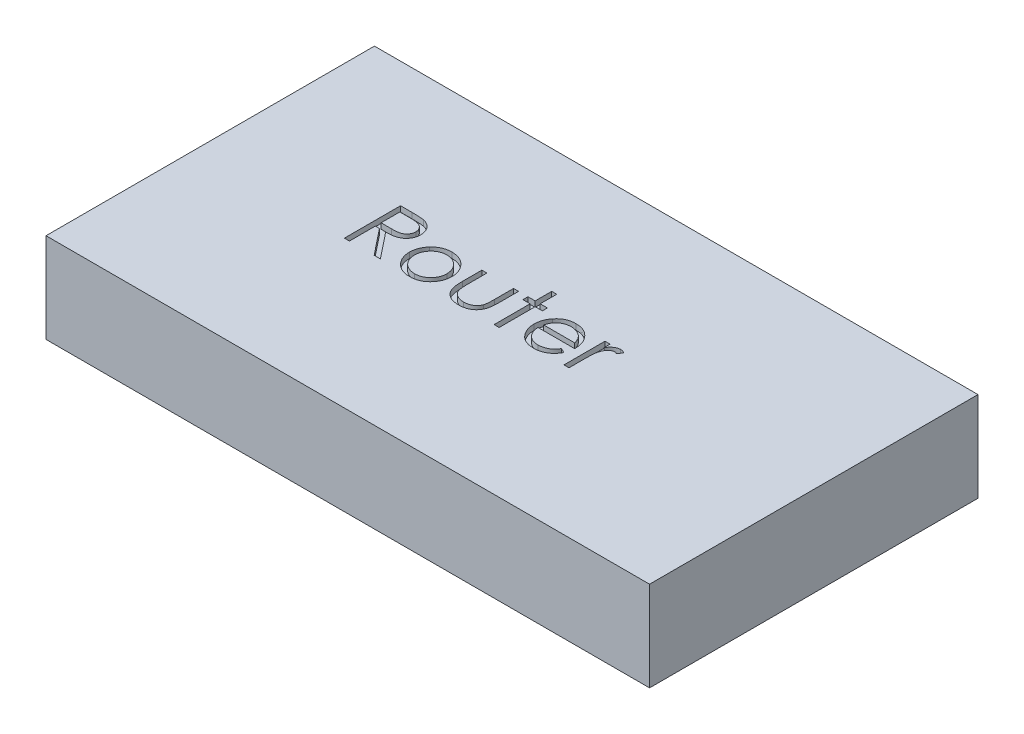
from build123d import *

# Parameters (mm, degrees)
SKETCH1_W           = 215
SKETCH1_H           = 117
BOSS_EXTRUDE1_DEPTH = 32
CUT_EXTRUDE2_DEPTH  = 2


with BuildPart() as part:
    # Sketch1 → Boss-Extrude1 (new body)
    with BuildSketch(Plane(origin=(0, 0, 0), x_dir=(1, 0, 0), z_dir=(0, 1, 0))):
        with Locations((-107.5, 58.5)):
            Rectangle(SKETCH1_W, SKETCH1_H)
    extrude(amount=BOSS_EXTRUDE1_DEPTH)

    # Sketch3 → Cut-Extrude2 (cut)
    # profile 1 of 6: a face of its own
    with BuildSketch(Plane(origin=(0, 32, 0), x_dir=(1, 0, 0), z_dir=(0, 1, 0))):
        with BuildLine():
            Line((-161.103395992, 72.399720579), (-157.100992146, 72.399720579))
            add(Edge.make_bspline(
                [(-157.100992146, 72.399720579), (-156.833899983, 72.398831516), (-156.321053444, 72.397124417), (-155.586349042, 72.387605772), (-154.91876563, 72.36032374), (-154.318652263, 72.33684612), (-153.786019949, 72.294035026), (-153.31923543, 72.253117043), (-152.920448587, 72.199553267), (-152.679043723, 72.149807993), (-152.569742146, 72.127284682)],
                knots=[0, 0, 0, 0, 1.410062039, 2.707475311, 3.878576406, 4.937260626, 5.877586885, 6.699081471, 7.410979367, 8, 8, 8, 8], degree=3))
            add(Edge.make_bspline(
                [(-152.569742146, 72.127284682), (-152.42341858, 72.091131737), (-152.133892926, 72.019597087), (-151.717035405, 71.868399368), (-151.319810697, 71.693430085), (-150.943868844, 71.487923112), (-150.591092894, 71.250352942), (-150.257845404, 70.984820814), (-149.942614185, 70.692779638), (-149.658147726, 70.366866258), (-149.389924574, 70.024943345), (-149.163703851, 69.655207592), (-148.968695395, 69.268570292), (-148.813435298, 68.861099333), (-148.688418307, 68.436746351), (-148.600268368, 67.991667513), (-148.547404438, 67.527890512), (-148.542022407, 67.211559605), (-148.539293428, 67.051162887)],
                knots=[0, 0, 0, 0, 1.027469482, 2.033020251, 3.019912614, 3.986113645, 4.951240523, 5.91722682, 6.890402269, 7.87763091, 8.8651537, 9.85103654, 10.82876324, 11.815024772, 12.821070561, 13.842952187, 14.906261191, 16, 16, 16, 16], degree=3))
            add(Edge.make_bspline(
                [(-148.539293428, 67.051162887), (-148.547687703, 66.784676575), (-148.564067108, 66.264692758), (-148.716781986, 65.51005915), (-148.966933527, 64.806120209), (-149.311638036, 64.153762278), (-149.750606468, 63.565701448), (-150.278176703, 63.04918456), (-150.894643055, 62.616956488), (-151.46852486, 62.317226176), (-151.975463144, 62.125266698), (-152.39279636, 61.99020179), (-152.848036231, 61.885847703), (-153.336821001, 61.792361236), (-153.861184746, 61.721780125), (-154.419870686, 61.670085299), (-155.013277266, 61.63777645), (-155.420929091, 61.632964993), (-155.630639582, 61.63048981)],
                knots=[0, 0, 0, 0, 1.260483769, 2.459530307, 3.627416485, 4.787058657, 5.939039949, 7.08810263, 8.267026773, 9.491475466, 10.141966685, 10.831826277, 11.566392101, 12.351337768, 13.187381173, 14.07005841, 15.007169909, 16, 16, 16, 16], degree=3))
            Line((-155.630639582, 61.63048981), (-148.282883172, 52.399720579))
            Line((-148.282883172, 52.399720579), (-150.502434454, 52.399720579))
            Line((-150.502434454, 52.399720579), (-157.850190864, 61.63048981))
            Line((-157.850190864, 61.63048981), (-159.308524197, 61.63048981))
            Line((-159.308524197, 61.63048981), (-159.308524197, 52.399720579))
            Line((-159.308524197, 52.399720579), (-161.103395992, 52.399720579))
            Line((-161.103395992, 52.399720579), (-161.103395992, 72.399720579))
        make_face()
        with BuildLine():
            Line((-159.308524197, 70.348438528), (-159.308524197, 63.681771861))
            Line((-159.308524197, 63.681771861), (-155.646665223, 63.653726989))
            add(Edge.make_bspline(
                [(-155.646665223, 63.653726989), (-155.475693572, 63.653651351), (-155.144301817, 63.653504743), (-154.664869447, 63.676326322), (-154.218468809, 63.70228814), (-153.806807368, 63.741998686), (-153.429701223, 63.793176239), (-153.087338862, 63.857193292), (-152.779161422, 63.931776507), (-152.419741203, 64.047214369), (-152.018389595, 64.230105902), (-151.582209824, 64.496194466), (-151.210767894, 64.830875147), (-150.896951538, 65.21358061), (-150.644783358, 65.634359174), (-150.467000191, 66.088166999), (-150.354186235, 66.563547559), (-150.340880261, 66.890279603), (-150.334165223, 67.055169297)],
                knots=[0, 0, 0, 0, 1.146690395, 2.22261258, 3.21895312, 4.145990853, 4.996080663, 5.770904154, 6.481378293, 7.121626537, 8.300444488, 9.431385265, 10.535395872, 11.636531494, 12.74115979, 13.810798291, 14.895190096, 16, 16, 16, 16], degree=3))
            add(Edge.make_bspline(
                [(-150.334165223, 67.055169297), (-150.341034486, 67.216006861), (-150.35464686, 67.534728225), (-150.46578268, 68.001333427), (-150.653722002, 68.441715999), (-150.906991933, 68.854084485), (-151.215558533, 69.228402975), (-151.577374605, 69.548672421), (-151.982547149, 69.812955077), (-152.361239711, 69.981837251), (-152.699720925, 70.085379269), (-152.993604697, 70.158243063), (-153.325670284, 70.216782885), (-153.697530048, 70.26368609), (-154.107596509, 70.304000057), (-154.557943087, 70.331153078), (-155.045581831, 70.347232302), (-155.383564295, 70.348027095), (-155.558524197, 70.348438528)],
                knots=[0, 0, 0, 0, 1.101028733, 2.181837193, 3.264309656, 4.369019818, 5.486613113, 6.575447106, 7.666700264, 8.788928104, 9.402425223, 10.0903467, 10.862060571, 11.710948788, 12.657782767, 13.684531032, 14.801375019, 16, 16, 16, 16], degree=3))
            Line((-155.558524197, 70.348438528), (-159.308524197, 70.348438528))
        make_face(mode=Mode.SUBTRACT)
    # profile 2 of 6: a face of its own
    with BuildSketch(Plane(origin=(0, 32, 0), x_dir=(1, 0, 0), z_dir=(0, 1, 0))):
        with BuildLine():
            add(Edge.make_bspline(
                [(-137.63384471, 67.271515451), (-137.359608865, 67.265676073), (-136.821899394, 67.25422648), (-136.03442576, 67.131855248), (-135.282739269, 66.944727451), (-134.563961028, 66.686032811), (-133.887296483, 66.339278808), (-133.242889373, 65.92551143), (-132.632506466, 65.435325181), (-132.266660584, 65.056136219), (-132.080960095, 64.863662887)],
                knots=[0, 0, 0, 0, 1.054011418, 2.066658804, 3.057071809, 4.030435133, 4.997543892, 5.974964718, 6.972108034, 8, 8, 8, 8], degree=3))
            add(Edge.make_bspline(
                [(-132.080960095, 64.863662887), (-131.921063215, 64.679582968), (-131.604363899, 64.314985584), (-131.198274077, 63.723810653), (-130.848436591, 63.111581506), (-130.568076814, 62.470168211), (-130.347019535, 61.80517009), (-130.1900727, 61.114301455), (-130.096718786, 60.399088043), (-130.084130403, 59.913351825), (-130.077754967, 59.667348784)],
                knots=[0, 0, 0, 0, 1.025258237, 2.030674902, 3.01204498, 3.988269485, 4.97094183, 5.956517959, 6.965070386, 8, 8, 8, 8], degree=3))
            add(Edge.make_bspline(
                [(-130.077754967, 59.667348784), (-130.083362609, 59.419919883), (-130.09444357, 58.930988836), (-130.199264235, 58.210878174), (-130.362299012, 57.512622044), (-130.595623801, 56.839143794), (-130.894812997, 56.188384781), (-131.25990264, 55.563187356), (-131.693454738, 54.962318023), (-132.184906148, 54.390878947), (-132.728059726, 53.864214863), (-133.31729486, 53.40519618), (-133.941032195, 53.011930326), (-134.607565643, 52.695150808), (-135.310808424, 52.445381092), (-136.052277385, 52.269952427), (-136.830820644, 52.163885663), (-137.362404766, 52.150265244), (-137.63384471, 52.143310323)],
                knots=[0, 0, 0, 0, 0.998656419, 1.973391657, 2.932242238, 3.890759089, 4.846373663, 5.82037756, 6.809684879, 7.83454468, 8.860553229, 9.859544525, 10.845671541, 11.83227036, 12.833544569, 13.85385346, 14.904124723, 16, 16, 16, 16], degree=3))
            add(Edge.make_bspline(
                [(-137.63384471, 52.143310323), (-137.906614536, 52.150288587), (-138.44084802, 52.16395587), (-139.222139345, 52.269540342), (-139.964937168, 52.445300243), (-140.669100588, 52.69597163), (-141.338499714, 53.011940451), (-141.965851125, 53.404007249), (-142.555564928, 53.864350993), (-143.09883341, 54.390842062), (-143.590254012, 54.962327527), (-144.02381406, 55.563184889), (-144.388901638, 56.188385423), (-144.688091374, 56.839143623), (-144.921416019, 57.51262209), (-145.084450835, 58.210878162), (-145.189271489, 58.930988839), (-145.200352452, 59.419919884), (-145.205960095, 59.667348784)],
                knots=[0, 0, 0, 0, 1.099876186, 2.154163076, 3.173186993, 4.173200201, 5.163417411, 6.152872554, 7.150605724, 8.17532212, 9.198891216, 10.186952605, 11.159729845, 12.11414092, 13.071450619, 14.029093627, 15.002601286, 16, 16, 16, 16], degree=3))
            add(Edge.make_bspline(
                [(-145.205960095, 59.667348784), (-145.199541179, 59.912014761), (-145.186832827, 60.396411346), (-145.093572776, 61.110280264), (-144.937238167, 61.79997963), (-144.715915902, 62.462410921), (-144.432971954, 63.101013413), (-144.088050308, 63.714755304), (-143.677818122, 64.303257021), (-143.362378399, 64.667383193), (-143.202754967, 64.851643656)],
                knots=[0, 0, 0, 0, 1.031353054, 2.041901799, 3.029428768, 4.008703097, 4.981709435, 5.96992636, 6.972712378, 8, 8, 8, 8], degree=3))
            add(Edge.make_bspline(
                [(-143.202754967, 64.851643656), (-143.017334447, 65.045786166), (-142.652672367, 65.427601573), (-142.039251066, 65.916358854), (-141.396429231, 66.338736418), (-140.712286796, 66.678600507), (-139.994099036, 66.946249179), (-139.238560508, 67.132337837), (-138.448414705, 67.25378558), (-137.908074013, 67.265546596), (-137.63384471, 67.271515451)],
                knots=[0, 0, 0, 0, 1.027980169, 2.021703884, 2.998553061, 3.971491411, 4.943284454, 5.930300938, 6.949603206, 8, 8, 8, 8], degree=3))
        make_face()
        with BuildLine():
            add(Edge.make_bspline(
                [(-137.641857531, 65.476643656), (-137.835786738, 65.471131704), (-138.218638902, 65.460250089), (-138.782179386, 65.377484919), (-139.324694552, 65.246356325), (-139.847213661, 65.060047432), (-140.347974646, 64.819482295), (-140.827456946, 64.524005951), (-141.287070888, 64.177531914), (-141.717825536, 63.780602362), (-142.113153034, 63.347008107), (-142.458741471, 62.885017485), (-142.752599222, 62.402124078), (-142.99740013, 61.897825728), (-143.179726919, 61.367011935), (-143.312144191, 60.815694042), (-143.394831279, 60.242748805), (-143.405610585, 59.853257272), (-143.4110883, 59.655329553)],
                knots=[0, 0, 0, 0, 1.021534396, 2.016698045, 2.994645724, 3.958388632, 4.93408049, 5.916473867, 6.921342795, 7.962252576, 8.998418191, 10.008913653, 10.997312074, 11.973003931, 12.956656626, 13.948281152, 14.957379055, 16, 16, 16, 16], degree=3))
            add(Edge.make_bspline(
                [(-143.4110883, 59.655329553), (-143.401906451, 59.399603684), (-143.383682197, 58.892035652), (-143.235480846, 58.144543523), (-142.987559246, 57.42693294), (-142.652774791, 56.743410734), (-142.233310684, 56.110997716), (-141.739098875, 55.547160663), (-141.175443444, 55.060384597), (-140.549063443, 54.656494051), (-139.872753055, 54.335581162), (-139.157002648, 54.108158443), (-138.410484397, 53.960320201), (-137.90030879, 53.945626062), (-137.641857531, 53.938182118)],
                knots=[0, 0, 0, 0, 1.016792936, 2.018143844, 3.017858371, 4.030088057, 5.03801393, 6.028138512, 7.003788237, 7.991172063, 8.984598303, 9.972568034, 10.972917682, 12, 12, 12, 12], degree=3))
            add(Edge.make_bspline(
                [(-137.641857531, 53.938182118), (-137.383421137, 53.945669433), (-136.873274874, 53.960449187), (-136.127793864, 54.107413871), (-135.413999739, 54.336577646), (-134.73839181, 54.656133131), (-134.112296933, 55.061918359), (-133.544587669, 55.544411942), (-133.054595605, 56.112491093), (-132.635546434, 56.7442484), (-132.295279333, 57.425873269), (-132.04851818, 58.144675968), (-131.899960546, 58.892001922), (-131.881784382, 59.399592383), (-131.872626762, 59.655329553)],
                knots=[0, 0, 0, 0, 1.02726834, 2.027799167, 3.010890988, 4.004497153, 4.992059811, 5.971914811, 6.958719428, 7.966827853, 8.981595046, 9.981490638, 10.983022906, 12, 12, 12, 12], degree=3))
            add(Edge.make_bspline(
                [(-131.872626762, 59.655329553), (-131.87810259, 59.853258455), (-131.888878185, 60.242752316), (-131.971592267, 60.815680622), (-132.103909637, 61.367061174), (-132.286604593, 61.89764405), (-132.530341815, 62.403429789), (-132.829866347, 62.883599658), (-133.174043635, 63.348608492), (-133.574141468, 63.779200725), (-134.004446485, 64.177686649), (-134.464246703, 64.524140302), (-134.943018009, 64.818183705), (-135.442324196, 65.06210508), (-135.964910297, 65.24466131), (-136.50666532, 65.378242062), (-137.067801377, 65.459900328), (-137.449281624, 65.471026851), (-137.641857531, 65.476643656)],
                knots=[0, 0, 0, 0, 1.042956736, 2.052379634, 3.044323526, 4.02829302, 5.004299113, 5.996692471, 7.007513377, 8.048758398, 9.090003419, 10.095195979, 11.07790575, 12.047570684, 13.018257071, 13.989683339, 14.985167495, 16, 16, 16, 16], degree=3))
        make_face(mode=Mode.SUBTRACT)
    # profile 3 of 6: a face of its own
    with BuildSketch(Plane(origin=(0, 32, 0), x_dir=(1, 0, 0), z_dir=(0, 1, 0))):
        with BuildLine():
            Line((-126.744421633, 67.015105195), (-124.949549838, 67.015105195))
            Line((-124.949549838, 67.015105195), (-124.949549838, 60.236259041))
            add(Edge.make_bspline(
                [(-124.949549838, 60.236259041), (-124.948738953, 60.037271902), (-124.947187768, 59.656618828), (-124.936668106, 59.108874904), (-124.911924713, 58.609350831), (-124.880988573, 58.15775805), (-124.841204938, 57.754172955), (-124.79387145, 57.400005201), (-124.740966183, 57.091238435), (-124.689179246, 56.905276402), (-124.66509471, 56.818791092)],
                knots=[0, 0, 0, 0, 1.388932606, 2.656963016, 3.823490214, 4.879454478, 5.816252168, 6.653371382, 7.373723809, 8, 8, 8, 8], degree=3))
            add(Edge.make_bspline(
                [(-124.66509471, 56.818791092), (-124.626457825, 56.710088972), (-124.549987304, 56.494944623), (-124.411281683, 56.184150308), (-124.239691188, 55.896291551), (-124.051920743, 55.620268278), (-123.8353527, 55.364256925), (-123.592727151, 55.128689818), (-123.332165796, 54.90466644), (-122.944994234, 54.639610485), (-122.415512714, 54.355522885), (-121.720354112, 54.110403922), (-120.966615679, 53.963913522), (-120.445674425, 53.946917779), (-120.177915223, 53.938182118)],
                knots=[0, 0, 0, 0, 0.725840625, 1.436591201, 2.137033971, 2.831655856, 3.53531722, 4.242432219, 4.957935707, 5.694543706, 7.190802206, 8.724350549, 10.316345118, 12, 12, 12, 12], degree=3))
            add(Edge.make_bspline(
                [(-120.177915223, 53.938182118), (-119.910180893, 53.947103538), (-119.392164503, 53.964364836), (-118.646707536, 54.105985057), (-117.965270882, 54.342588994), (-117.354694017, 54.672917061), (-116.817746359, 55.07715742), (-116.370292538, 55.55149347), (-116.001108226, 56.080918538), (-115.839911537, 56.475914417), (-115.75884471, 56.674560323)],
                knots=[0, 0, 0, 0, 1.157059328, 2.238695713, 3.266970494, 4.264342957, 5.228770407, 6.160125903, 7.074715775, 8, 8, 8, 8], degree=3))
            add(Edge.make_bspline(
                [(-115.75884471, 56.674560323), (-115.734877681, 56.754367744), (-115.681892434, 56.93080246), (-115.624964711, 57.230115308), (-115.573682073, 57.587055906), (-115.529892495, 58.003959955), (-115.498662994, 58.479737969), (-115.481828557, 59.014241261), (-115.462809841, 59.605791891), (-115.462521177, 60.019893373), (-115.462370351, 60.236259041)],
                knots=[0, 0, 0, 0, 0.557542046, 1.232589297, 2.036731608, 2.971723315, 4.038036528, 5.22795436, 6.551621927, 8, 8, 8, 8], degree=3))
            Line((-115.462370351, 60.236259041), (-115.462370351, 67.015105195))
            Line((-115.462370351, 67.015105195), (-113.667498556, 67.015105195))
            Line((-113.667498556, 67.015105195), (-113.667498556, 59.899720579))
            add(Edge.make_bspline(
                [(-113.667498556, 59.899720579), (-113.670022527, 59.657965314), (-113.674919375, 59.188927029), (-113.706389909, 58.507303534), (-113.760387695, 57.872090706), (-113.842345895, 57.282952307), (-113.938721179, 56.740338126), (-114.063042739, 56.24355272), (-114.211489811, 55.794126698), (-114.378949897, 55.384173687), (-114.57678914, 55.012477149), (-114.787229257, 54.659701054), (-115.030227954, 54.334598567), (-115.286057864, 54.020986354), (-115.570638754, 53.734463341), (-115.878637948, 53.468454907), (-116.205720347, 53.218894726), (-116.559144336, 52.995515986), (-116.93375041, 52.794278013), (-117.330001021, 52.615900424), (-117.752749583, 52.47474284), (-118.196541794, 52.352967608), (-118.663551961, 52.257456355), (-119.153329865, 52.190104545), (-119.665710529, 52.14881694), (-120.014907442, 52.145176684), (-120.193940864, 52.143310323)],
                knots=[0, 0, 0, 0, 1.493040784, 2.896703357, 4.213163133, 5.428574705, 6.569057535, 7.615249723, 8.588095153, 9.490268104, 10.346124644, 11.18633936, 12.024365274, 12.850166724, 13.684164916, 14.514361689, 15.362232829, 16.222528818, 17.093394965, 17.986930858, 18.902426812, 19.842810585, 20.827885679, 21.843828298, 22.894529745, 24, 24, 24, 24], degree=3))
            add(Edge.make_bspline(
                [(-120.193940864, 52.143310323), (-120.37163523, 52.145251506), (-120.720821202, 52.149066113), (-121.233228312, 52.189876443), (-121.724363205, 52.257351704), (-122.192479768, 52.353667232), (-122.638047753, 52.473890488), (-123.062871981, 52.616767834), (-123.461978055, 52.794370587), (-123.840160935, 52.994242344), (-124.194460296, 53.220329632), (-124.526509314, 53.468147001), (-124.835862757, 53.737324504), (-125.12258886, 54.026737974), (-125.382663012, 54.33997761), (-125.619326107, 54.674523669), (-125.836221565, 55.027061318), (-126.032523225, 55.404565103), (-126.201161828, 55.819262302), (-126.350048947, 56.278102857), (-126.471824024, 56.786117239), (-126.570923843, 57.342871116), (-126.65064636, 57.945699925), (-126.705995745, 58.598090869), (-126.736943349, 59.298454824), (-126.741875128, 59.782168482), (-126.744421633, 60.031932118)],
                knots=[0, 0, 0, 0, 1.083640291, 2.129454052, 3.13281866, 4.105697902, 5.042300162, 5.946461698, 6.836384745, 7.703652036, 8.553297018, 9.397182691, 10.228592656, 11.052265423, 11.879314572, 12.708807002, 13.549817954, 14.402308542, 15.300838682, 16.27712199, 17.341985831, 18.484375296, 19.725102775, 21.0496083, 22.476576903, 24, 24, 24, 24], degree=3))
            Line((-126.744421633, 60.031932118), (-126.744421633, 67.015105195))
        make_face()
    # profile 4 of 6: a face of its own
    with BuildSketch(Plane(origin=(0, 32, 0), x_dir=(1, 0, 0), z_dir=(0, 1, 0))):
        Polygon((-107.770062659, 72.912541092), (-105.975190864, 72.912541092), (-105.975190864, 67.015105195), (-103.4110883, 67.015105195), (-103.4110883, 65.2202334), (-105.975190864, 65.2202334), (-105.975190864, 52.399720579), (-107.770062659, 52.399720579), (-107.770062659, 65.2202334), (-110.334165223, 65.2202334), (-110.334165223, 67.015105195), (-107.770062659, 67.015105195), align=None)
    # profile 5 of 6: a face of its own
    with BuildSketch(Plane(origin=(0, 32, 0), x_dir=(1, 0, 0), z_dir=(0, 1, 0))):
        with BuildLine():
            Line((-88.338972915, 57.015105195), (-86.744421633, 56.177765451))
            add(Edge.make_bspline(
                [(-86.744421633, 56.177765451), (-86.871487892, 55.952374987), (-87.118708512, 55.513854399), (-87.543855643, 54.911386625), (-87.989524629, 54.369399677), (-88.475833017, 53.902373081), (-88.988231183, 53.49522231), (-89.529560639, 53.139006169), (-90.102639597, 52.835471767), (-90.707495167, 52.579743036), (-91.349206888, 52.383117355), (-92.029329839, 52.244236093), (-92.749166956, 52.158388844), (-93.242573698, 52.148416611), (-93.495222915, 52.143310323)],
                knots=[0, 0, 0, 0, 1.120438281, 2.179929193, 3.190490725, 4.156257408, 5.095198341, 6.022838206, 6.959905092, 7.901321166, 8.864066838, 9.862729781, 10.905609505, 12, 12, 12, 12], degree=3))
            add(Edge.make_bspline(
                [(-93.495222915, 52.143310323), (-93.776034216, 52.14986561), (-94.323815711, 52.162653077), (-95.121185694, 52.272895731), (-95.871925228, 52.452737781), (-96.575992104, 52.703969447), (-97.231662119, 53.032125584), (-97.840238432, 53.431894052), (-98.404921437, 53.901221221), (-98.907916918, 54.444172327), (-99.360739105, 55.025212083), (-99.760315219, 55.63067428), (-100.094357682, 56.259035563), (-100.366086884, 56.9062957), (-100.585543255, 57.568375092), (-100.738495848, 58.251297764), (-100.826665836, 58.953215388), (-100.840176954, 59.428057306), (-100.846985736, 59.667348784)],
                knots=[0, 0, 0, 0, 1.145258523, 2.234067595, 3.276747158, 4.290159414, 5.277019952, 6.260822364, 7.254936242, 8.264827045, 9.274100331, 10.257902744, 11.220704747, 12.172965371, 13.118907548, 14.062713208, 15.023725156, 16, 16, 16, 16], degree=3))
            add(Edge.make_bspline(
                [(-100.846985736, 59.667348784), (-100.8409335, 59.891890672), (-100.828938767, 60.336903042), (-100.753334268, 60.995563296), (-100.619344021, 61.635725882), (-100.435479313, 62.257922728), (-100.198043621, 62.861112065), (-99.907573797, 63.445661), (-99.563617352, 64.010947513), (-99.298059216, 64.367536849), (-99.164293428, 64.547156477)],
                knots=[0, 0, 0, 0, 1.024358464, 2.0301432, 3.019427413, 4.004406732, 4.986367066, 5.972626655, 6.978780325, 8, 8, 8, 8], degree=3))
            add(Edge.make_bspline(
                [(-99.164293428, 64.547156477), (-98.98310667, 64.76355002), (-98.626472689, 65.189482308), (-98.023293515, 65.749129884), (-97.370149536, 66.217951457), (-96.675225959, 66.606563663), (-95.930446107, 66.901841646), (-95.145821587, 67.121884973), (-94.312418237, 67.245187893), (-93.742674118, 67.262604085), (-93.451152403, 67.271515451)],
                knots=[0, 0, 0, 0, 1.030682036, 2.02871468, 2.997146059, 3.962720338, 4.930598197, 5.918074684, 6.934738563, 8, 8, 8, 8], degree=3))
            add(Edge.make_bspline(
                [(-93.451152403, 67.271515451), (-93.151451801, 67.263778029), (-92.563507538, 67.24859897), (-91.706181132, 67.107877065), (-90.894977038, 66.88471961), (-90.13021987, 66.569555093), (-89.411832095, 66.162929083), (-88.74448324, 65.659261417), (-88.116760311, 65.074015204), (-87.751568432, 64.623939722), (-87.565735736, 64.394912887)],
                knots=[0, 0, 0, 0, 1.056321875, 2.072262726, 3.055038591, 4.01806755, 4.982017516, 5.957941055, 6.960871419, 8, 8, 8, 8], degree=3))
            add(Edge.make_bspline(
                [(-87.565735736, 64.394912887), (-87.439296088, 64.222320993), (-87.187258414, 63.878286029), (-86.871560699, 63.317307989), (-86.597518442, 62.730390307), (-86.378472951, 62.108045752), (-86.201104372, 61.457648151), (-86.072779694, 60.774547895), (-85.99752473, 60.058948402), (-85.982732174, 59.571368085), (-85.975190864, 59.322797502)],
                knots=[0, 0, 0, 0, 0.94817472, 1.890038105, 2.849395472, 3.817997239, 4.812318967, 5.836947057, 6.897266129, 8, 8, 8, 8], degree=3))
            Line((-85.975190864, 59.322797502), (-99.052113941, 59.322797502))
            add(Edge.make_bspline(
                [(-99.052113941, 59.322797502), (-99.04331619, 59.130223421), (-99.026015767, 58.751534257), (-98.945357807, 58.197415496), (-98.818221956, 57.669567827), (-98.639541598, 57.171950444), (-98.423159626, 56.698064001), (-98.158098387, 56.25142379), (-97.841872364, 55.834064189), (-97.489154082, 55.442251975), (-97.096542109, 55.093333339), (-96.683497839, 54.781037475), (-96.244106039, 54.519291208), (-95.781831276, 54.306834695), (-95.297421075, 54.140512889), (-94.790722817, 54.026982485), (-94.262733581, 53.950941875), (-93.902815101, 53.942486645), (-93.71958189, 53.938182118)],
                knots=[0, 0, 0, 0, 1.094153842, 2.151609401, 3.174256925, 4.172055639, 5.149267565, 6.128595816, 7.11444997, 8.118368179, 9.117203808, 10.09244225, 11.054858984, 12.015122123, 12.976791628, 13.957293641, 14.960065497, 16, 16, 16, 16], degree=3))
            add(Edge.make_bspline(
                [(-93.71958189, 53.938182118), (-93.540432475, 53.941656727), (-93.18496567, 53.948551019), (-92.655589342, 54.01559051), (-92.134792042, 54.123992085), (-91.624729281, 54.271934885), (-91.135753019, 54.45237404), (-90.682921304, 54.670104655), (-90.266462929, 54.910960351), (-89.87722312, 55.186444208), (-89.499674586, 55.523633848), (-89.125146093, 55.944409397), (-88.723565216, 56.442052413), (-88.472196115, 56.816599075), (-88.338972915, 57.015105195)],
                knots=[0, 0, 0, 0, 0.99110716, 1.966546729, 2.947904876, 3.932708344, 4.903319531, 5.828989031, 6.710028674, 7.56322171, 8.463672341, 9.504779593, 10.677557249, 12, 12, 12, 12], degree=3))
        make_face()
        with BuildLine():
            add(Edge.make_bspline(
                [(-87.770062659, 61.117669297), (-87.835757656, 61.355742861), (-87.962199379, 61.813957836), (-88.226407176, 62.44847721), (-88.523958837, 63.012408073), (-88.876083016, 63.501434547), (-89.275047163, 63.935740336), (-89.735876778, 64.315275108), (-90.252653312, 64.6548034), (-90.822705545, 64.941389111), (-91.426372888, 65.185331161), (-92.058408271, 65.348903251), (-92.703309916, 65.460957779), (-93.139505838, 65.471392684), (-93.359004967, 65.476643656)],
                knots=[0, 0, 0, 0, 1.154881502, 2.222775134, 3.210006277, 4.132804581, 5.035138423, 5.962687519, 6.919655026, 7.923214229, 8.944639381, 9.960483929, 10.97369054, 12, 12, 12, 12], degree=3))
            add(Edge.make_bspline(
                [(-93.359004967, 65.476643656), (-93.538144615, 65.47314839), (-93.892266039, 65.466238984), (-94.413986428, 65.400695388), (-94.915013279, 65.292353417), (-95.399043494, 65.143982237), (-95.85973417, 64.946218794), (-96.306561417, 64.714314642), (-96.728163682, 64.431219877), (-96.991828227, 64.215454992), (-97.125030608, 64.106451348)],
                knots=[0, 0, 0, 0, 1.04873581, 2.073130211, 3.073294108, 4.04793562, 5.032784715, 6.005352987, 6.992311501, 8, 8, 8, 8], degree=3))
            add(Edge.make_bspline(
                [(-97.125030608, 64.106451348), (-97.22042079, 64.020198116), (-97.413467272, 63.845642596), (-97.671413109, 63.544904273), (-97.918387238, 63.220609632), (-98.143150968, 62.860351777), (-98.349308605, 62.46823304), (-98.542222761, 62.047560838), (-98.715859401, 61.595142951), (-98.813551458, 61.27987187), (-98.863812659, 61.117669297)],
                knots=[0, 0, 0, 0, 0.879870761, 1.780643979, 2.707998968, 3.669668524, 4.684282772, 5.740141944, 6.837334558, 8, 8, 8, 8], degree=3))
            Line((-98.863812659, 61.117669297), (-87.770062659, 61.117669297))
        make_face(mode=Mode.SUBTRACT)
    # profile 6 of 6: a face of its own
    with BuildSketch(Plane(origin=(0, 32, 0), x_dir=(1, 0, 0), z_dir=(0, 1, 0))):
        with BuildLine():
            Line((-82.898267787, 67.015105195), (-81.103395992, 67.015105195))
            Line((-81.103395992, 67.015105195), (-81.103395992, 64.863662887))
            add(Edge.make_bspline(
                [(-81.103395992, 64.863662887), (-80.970888799, 65.063981906), (-80.717469823, 65.447090473), (-80.296253084, 65.953772193), (-79.864805476, 66.373286745), (-79.421061549, 66.707592567), (-78.961758121, 66.957953246), (-78.496975539, 67.141342017), (-78.019401426, 67.249783819), (-77.698476145, 67.26426187), (-77.537690864, 67.271515451)],
                knots=[0, 0, 0, 0, 1.2804753, 2.448899062, 3.506932113, 4.484331642, 5.4025378, 6.288909075, 7.142734305, 8, 8, 8, 8], degree=3))
            add(Edge.make_bspline(
                [(-77.537690864, 67.271515451), (-77.412968999, 67.264712442), (-77.156345654, 67.250714808), (-76.767873713, 67.152367239), (-76.367625416, 66.995349967), (-76.109668918, 66.847691552), (-75.975190864, 66.770714169)],
                knots=[0, 0, 0, 0, 0.901110191, 1.854092781, 2.881294221, 4, 4, 4, 4], degree=3))
            Line((-75.975190864, 66.770714169), (-76.960767787, 65.216226989))
            add(Edge.make_bspline(
                [(-76.960767787, 65.216226989), (-77.047105051, 65.254742796), (-77.210989705, 65.32785317), (-77.450730084, 65.414378942), (-77.671766294, 65.465327032), (-77.812586627, 65.473045418), (-77.878235736, 65.476643656)],
                knots=[0, 0, 0, 0, 1.180555205, 2.24091978, 3.179933427, 4, 4, 4, 4], degree=3))
            add(Edge.make_bspline(
                [(-77.878235736, 65.476643656), (-78.022268499, 65.467043443), (-78.316053584, 65.44746179), (-78.747393581, 65.293525745), (-79.165949041, 65.044810088), (-79.49835854, 64.768975163), (-79.755742842, 64.502987749), (-79.939401274, 64.270711163), (-80.107874114, 64.010261839), (-80.268846802, 63.726092218), (-80.41551134, 63.41335024), (-80.552395164, 63.075160449), (-80.676160095, 62.711131142), (-80.746732919, 62.457516741), (-80.782883172, 62.327605195)],
                knots=[0, 0, 0, 0, 1.125678352, 2.296057538, 3.5422874, 4.923748041, 5.663163013, 6.437101912, 7.23742474, 8.08941207, 8.991984279, 9.93940061, 10.944477711, 12, 12, 12, 12], degree=3))
            add(Edge.make_bspline(
                [(-80.782883172, 62.327605195), (-80.80992542, 62.211735631), (-80.869821944, 61.955093353), (-80.928059303, 61.524530355), (-80.985599405, 61.015823733), (-81.02615151, 60.427557488), (-81.063740322, 59.761200666), (-81.084940792, 59.015738119), (-81.102673024, 58.190404684), (-81.103147692, 57.61340838), (-81.103395992, 57.311579553)],
                knots=[0, 0, 0, 0, 0.566838948, 1.255505196, 2.06880316, 3.007127437, 4.065329342, 5.249902469, 6.561414163, 8, 8, 8, 8], degree=3))
            Line((-81.103395992, 57.311579553), (-81.103395992, 52.399720579))
            Line((-81.103395992, 52.399720579), (-82.898267787, 52.399720579))
            Line((-82.898267787, 52.399720579), (-82.898267787, 67.015105195))
        make_face()
    extrude(amount=-CUT_EXTRUDE2_DEPTH, mode=Mode.SUBTRACT)


solid = part.part
